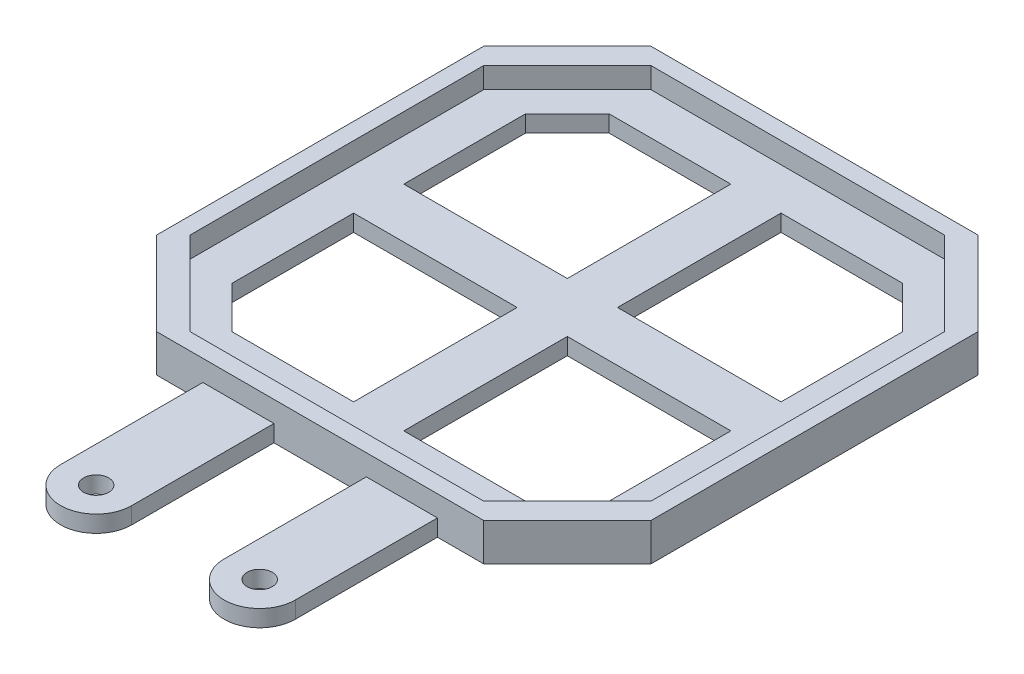
from build123d import *

# Parameters (mm, degrees)
SALIENTE_EXTRUIR1_DEPTH      = 2
SALIENTE_EXTRUIR3_DEPTH      = 2.5
SALIENTE_EXTRUIR3_DEPTH_BACK = 2
CROQUIS4_R                   = 1.5
SALIENTE_EXTRUIR4_DEPTH      = 2
CORTAR_EXTRUIR1_DEPTH        = 2


with BuildPart() as part:
    # Croquis1 → Saliente-Extruir1 (new body)
    with BuildSketch(Plane(origin=(0, 0, 0), x_dir=(1, 0, 0), z_dir=(0, 1, 0))):
        Polygon((-0.5, 44.6), (-0.5, 9.5), (9.5, -0.5), (44.6, -0.5), (54.6, 9.5), (54.6, 44.6), (44.6, 54.6), (9.5, 54.6), align=None)
    extrude(amount=SALIENTE_EXTRUIR1_DEPTH)

    # Croquis2 → Saliente-Extruir3 (add, two sides: drawn at the far end of the back side and taken through both)
    with BuildSketch(Plane(origin=(0, 2, 0), x_dir=(1, 0, 0), z_dir=(0, 1, 0)).offset(-SALIENTE_EXTRUIR3_DEPTH_BACK)):
        Polygon((7.5, 56.6), (-2.5, 46.6), (-2.5, 7.5), (7.5, -2.5), (46.6, -2.5), (56.6, 7.5), (56.6, 46.6), (46.6, 56.6), align=None)
        Polygon((9.5, 54.6), (44.6, 54.6), (54.6, 44.6), (54.6, 9.5), (44.6, -0.5), (9.5, -0.5), (-0.5, 9.5), (-0.5, 44.6), align=None, mode=Mode.SUBTRACT)
    extrude(amount=SALIENTE_EXTRUIR3_DEPTH + SALIENTE_EXTRUIR3_DEPTH_BACK)

    # Croquis4 → Saliente-Extruir4 (add)
    # profile 1 of 2: a face of its own
    with BuildSketch(Plane.XZ):
        with BuildLine():
            Line((13.025, 2.5), (21.525, 2.5))
            Line((21.525, 2.5), (21.525, 19.5))
            ThreePointArc((21.525, 19.5), (17.275, 23.75), (13.025, 19.5))
            Line((13.025, 19.5), (13.025, 2.5))
        make_face()
        with Locations((17.275, 19.5)):
            Circle(CROQUIS4_R, mode=Mode.SUBTRACT)
    # profile 2 of 2: a face of its own
    with BuildSketch(Plane.XZ):
        with BuildLine():
            Line((32.575, 19.5), (32.575, 2.5))
            Line((32.575, 2.5), (41.075, 2.5))
            Line((41.075, 2.5), (41.075, 19.5))
            ThreePointArc((41.075, 19.5), (36.825, 23.75), (32.575, 19.5))
        make_face()
        with Locations((36.825, 19.5)):
            Circle(CROQUIS4_R, mode=Mode.SUBTRACT)
    extrude(amount=-SALIENTE_EXTRUIR4_DEPTH)

    # Croquis6 → Cortar-Extruir1 (cut)
    with BuildSketch(Plane(origin=(0, 2, 0), x_dir=(1, 0, 0), z_dir=(0, 1, 0))):
        Polygon((9.5, 49.6), (4.5, 44.6), (4.5, 30.05), (24.05, 30.05), (24.05, 49.6), align=None)
        Polygon((4.5, 24.05), (4.5, 9.5), (9.5, 4.5), (24.05, 4.5), (24.05, 24.05), align=None)
        Polygon((30.05, 4.5), (44.6, 4.5), (49.6, 9.5), (49.6, 24.05), (30.05, 24.05), align=None)
        Polygon((49.6, 30.05), (49.6, 44.6), (44.6, 49.6), (30.05, 49.6), (30.05, 30.05), align=None)
    extrude(amount=-CORTAR_EXTRUIR1_DEPTH, mode=Mode.SUBTRACT)


solid = part.part
